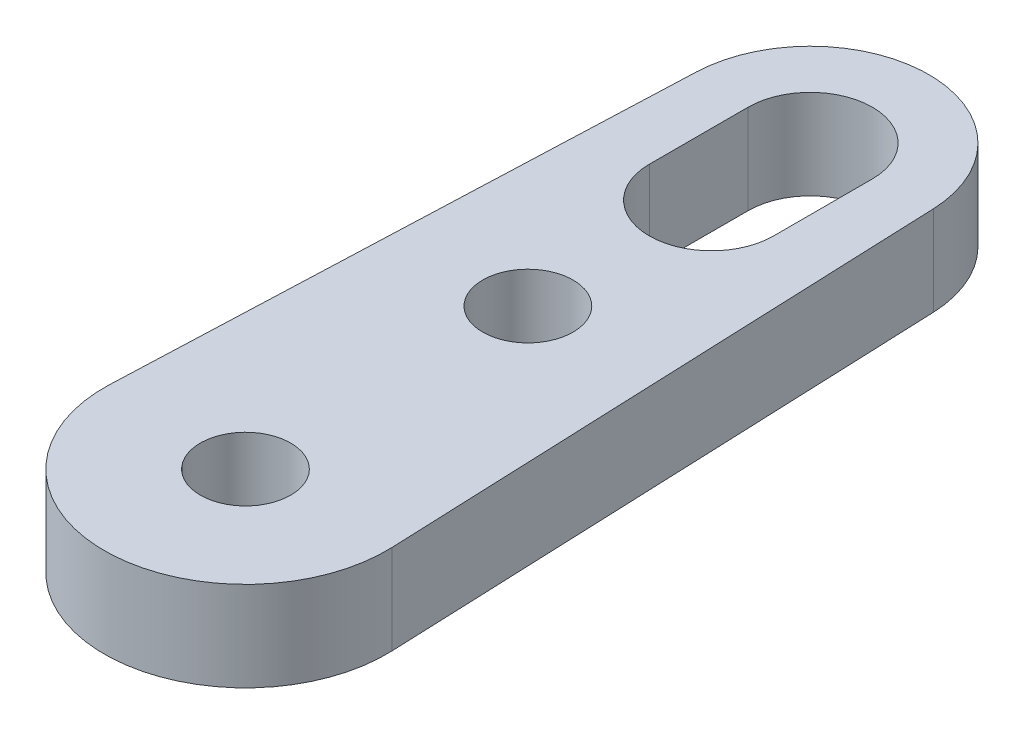
from build123d import *

# Parameters (mm, degrees)
BOSS_EXTRUDE1_DEPTH = 3.175
SKETCH2_R           = 1.6
CUT_EXTRUDE1_DEPTH  = 25.914265492
CUT_EXTRUDE2_DEPTH  = 25.914265492


with BuildPart() as part:
    # Sketch1 → Boss-Extrude1 (new body)
    with BuildSketch(Plane(origin=(0, 0, 0), x_dir=(1, 0, 0), z_dir=(0, 1, 0))):
        with BuildLine():
            Line((-4.196638655, 20.168), (-4.995998399, 0.2))
            ThreePointArc((-4.995998399, 0.2), (0, -5), (4.995998399, 0.2))
            Line((4.995998399, 0.2), (4.196638655, 20.168))
            ThreePointArc((4.196638655, 20.168), (0, 24.2), (-4.196638655, 20.168))
        make_face()
    extrude(amount=BOSS_EXTRUDE1_DEPTH)

    # Sketch2 → Cut-Extrude1 (cut, through all)
    with BuildSketch(Plane(origin=(0, 3.175, 0), x_dir=(1, 0, 0), z_dir=(0, 1, 0))):
        with Locations(Location((0, 0, 0), (0, 0, 270))):
            Circle(SKETCH2_R)
        with Locations(Location((0, 10, 0), (0, 0, 270))):
            Circle(SKETCH2_R)
    extrude(amount=-CUT_EXTRUDE1_DEPTH, mode=Mode.SUBTRACT)

    # Sketch3 → Cut-Extrude2 (cut, through all)
    with BuildSketch(Plane(origin=(0, 3.175, 0), x_dir=(1, 0, 0), z_dir=(0, 1, 0))):
        with BuildLine():
            Line((-2.2, 16.5), (-2.2, 20))
            ThreePointArc((-2.2, 20), (0, 22.2), (2.2, 20))
            Line((2.2, 20), (2.2, 16.5))
            ThreePointArc((2.2, 16.5), (0, 14.3), (-2.2, 16.5))
        make_face()
    extrude(amount=-CUT_EXTRUDE2_DEPTH, mode=Mode.SUBTRACT)


solid = part.part
